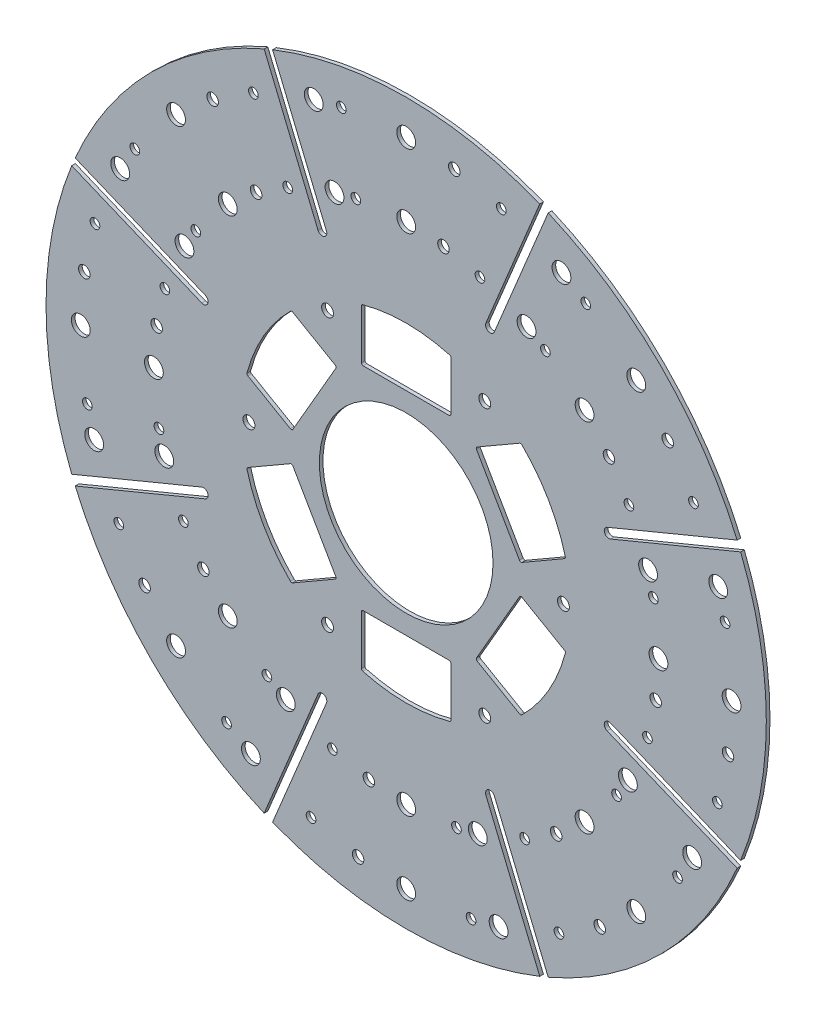
from build123d import *

# Parameters (mm, degrees)
ESBO_O1_R                = 197
ESBO_O1_R_2              = 47.5
RESSALTO_EXTRUS_O1_DEPTH = 2
CORTE_EXTRUS_O1_DEPTH    = 2
ESBO_O3_R                = 5.15
ESBO_O3_R_2              = 2.65
ESBO_O3_R_3              = 3.15
CORTE_EXTRUS_O2_DEPTH    = 2
CORTE_EXTRUS_O3_DEPTH    = 2
ESBO_O5_R                = 3.25
CORTE_EXTRUS_O4_DEPTH    = 2
FILETE1_R                = 1


with BuildPart() as part:
    # Esboço1 → Ressalto-extrusão1 (new body)
    with BuildSketch(Plane.XY):
        Circle(ESBO_O1_R)
        Circle(ESBO_O1_R_2, mode=Mode.SUBTRACT)
    extrude(amount=RESSALTO_EXTRUS_O1_DEPTH)

    # Esboço2 → Corte-extrusão1 (cut)
    with BuildSketch(Plane.XY.offset(2)):
        with BuildLine():
            Line((73.078937345, 182.960976486), (77.698335007, 181.047559324))
            Line((77.698335007, 181.047559324), (48.221743919, 109.884773346))
            ThreePointArc((48.221743919, 109.884773346), (44.955336507, 108.531783096), (43.602346257, 111.798190508))
            Line((43.602346257, 111.798190508), (73.078937345, 182.960976486))
        make_face()
        with BuildLine():
            Line((181.047559324, 77.698335007), (182.960976486, 73.078937345))
            Line((182.960976486, 73.078937345), (111.798190508, 43.602346257))
            ThreePointArc((111.798190508, 43.602346257), (108.531783096, 44.955336507), (109.884773346, 48.221743919))
            Line((109.884773346, 48.221743919), (181.047559324, 77.698335007))
        make_face()
        with BuildLine():
            Line((182.960976486, -73.078937345), (181.047559324, -77.698335007))
            Line((181.047559324, -77.698335007), (109.884773346, -48.221743919))
            ThreePointArc((109.884773346, -48.221743919), (108.531783096, -44.955336507), (111.798190508, -43.602346257))
            Line((111.798190508, -43.602346257), (182.960976486, -73.078937345))
        make_face()
        with BuildLine():
            Line((77.698335007, -181.047559324), (73.078937345, -182.960976486))
            Line((73.078937345, -182.960976486), (43.602346257, -111.798190508))
            ThreePointArc((43.602346257, -111.798190508), (44.955336507, -108.531783096), (48.221743919, -109.884773346))
            Line((48.221743919, -109.884773346), (77.698335007, -181.047559324))
        make_face()
        with BuildLine():
            Line((-73.078937345, -182.960976486), (-77.698335007, -181.047559324))
            Line((-77.698335007, -181.047559324), (-48.221743919, -109.884773346))
            ThreePointArc((-48.221743919, -109.884773346), (-44.955336507, -108.531783096), (-43.602346257, -111.798190508))
            Line((-43.602346257, -111.798190508), (-73.078937345, -182.960976486))
        make_face()
        with BuildLine():
            Line((-181.047559324, -77.698335007), (-182.960976486, -73.078937345))
            Line((-182.960976486, -73.078937345), (-111.798190508, -43.602346257))
            ThreePointArc((-111.798190508, -43.602346257), (-108.531783096, -44.955336507), (-109.884773346, -48.221743919))
            Line((-109.884773346, -48.221743919), (-181.047559324, -77.698335007))
        make_face()
        with BuildLine():
            Line((-182.960976486, 73.078937345), (-181.047559324, 77.698335007))
            Line((-181.047559324, 77.698335007), (-109.884773346, 48.221743919))
            ThreePointArc((-109.884773346, 48.221743919), (-108.531783096, 44.955336507), (-111.798190508, 43.602346257))
            Line((-111.798190508, 43.602346257), (-182.960976486, 73.078937345))
        make_face()
        with BuildLine():
            Line((-77.698335007, 181.047559324), (-73.078937345, 182.960976486))
            Line((-73.078937345, 182.960976486), (-43.602346257, 111.798190508))
            ThreePointArc((-43.602346257, 111.798190508), (-44.955336507, 108.531783096), (-48.221743919, 109.884773346))
            Line((-48.221743919, 109.884773346), (-77.698335007, 181.047559324))
        make_face()
    extrude(amount=-CORTE_EXTRUS_O1_DEPTH, mode=Mode.SUBTRACT)

    # Esboço3 → Corte-extrusão2 (cut)
    with BuildSketch(Plane.XY.offset(2)):
        with Locations((-50.554731357, 170.669912807)):
            Circle(ESBO_O3_R)
        with Locations((-39.194117569, 132.317123412)):
            Circle(ESBO_O3_R)
        with Locations((-35.487492326, 174.426597423)):
            Circle(ESBO_O3_R_2)
        with Locations((-27.51277495, 135.229609238)):
            Circle(ESBO_O3_R_2)
        with Locations((0, 178)):
            Circle(ESBO_O3_R)
        with Locations((0, 138)):
            Circle(ESBO_O3_R)
        with Locations((26.310075181, 176.044823678)):
            Circle(ESBO_O3_R_3)
        with Locations((20.397698736, 136.484189144)):
            Circle(ESBO_O3_R_3)
        with Locations((52.042163441, 170.222246561)):
            Circle(ESBO_O3_R_2)
        with Locations((40.347295252, 131.970056323)):
            Circle(ESBO_O3_R_2)
        with Locations((84.934259326, 156.429446054)):
            Circle(ESBO_O3_R)
        with Locations((65.847908916, 121.276761547)):
            Circle(ESBO_O3_R)
        with Locations((98.244783386, 148.431676328)):
            Circle(ESBO_O3_R_2)
        with Locations((76.167303973, 115.076243445)):
            Circle(ESBO_O3_R_2)
        with Locations((125.865007051, 125.865007051)):
            Circle(ESBO_O3_R)
        with Locations((97.580735804, 97.580735804)):
            Circle(ESBO_O3_R)
        with Locations((143.08652119, 105.878456042)):
            Circle(ESBO_O3_R_3)
        with Locations((110.932246765, 82.085544572)):
            Circle(ESBO_O3_R_3)
        with Locations((157.164671529, 83.565938176)):
            Circle(ESBO_O3_R_2)
        with Locations((121.846767815, 64.787075664)):
            Circle(ESBO_O3_R_2)
        with Locations((170.669912807, 50.554731357)):
            Circle(ESBO_O3_R)
        with Locations((132.317123412, 39.194117569)):
            Circle(ESBO_O3_R)
        with Locations((174.426597423, 35.487492326)):
            Circle(ESBO_O3_R_2)
        with Locations((135.229609238, 27.51277495)):
            Circle(ESBO_O3_R_2)
        with Locations((178, 0)):
            Circle(ESBO_O3_R)
        with Locations((138, 0)):
            Circle(ESBO_O3_R)
        with Locations((176.044823678, -26.310075181)):
            Circle(ESBO_O3_R_3)
        with Locations((136.484189144, -20.397698736)):
            Circle(ESBO_O3_R_3)
        with Locations((170.222246561, -52.042163441)):
            Circle(ESBO_O3_R_2)
        with Locations((131.970056323, -40.347295252)):
            Circle(ESBO_O3_R_2)
        with Locations((156.429446054, -84.934259326)):
            Circle(ESBO_O3_R)
        with Locations((121.276761547, -65.847908916)):
            Circle(ESBO_O3_R)
        with Locations((148.431676328, -98.244783386)):
            Circle(ESBO_O3_R_2)
        with Locations((115.076243445, -76.167303973)):
            Circle(ESBO_O3_R_2)
        with Locations((125.865007051, -125.865007051)):
            Circle(ESBO_O3_R)
        with Locations((97.580735804, -97.580735804)):
            Circle(ESBO_O3_R)
        with Locations((105.878456042, -143.08652119)):
            Circle(ESBO_O3_R_3)
        with Locations((82.085544572, -110.932246765)):
            Circle(ESBO_O3_R_3)
        with Locations((83.565938176, -157.164671529)):
            Circle(ESBO_O3_R_2)
        with Locations((64.787075664, -121.846767815)):
            Circle(ESBO_O3_R_2)
        with Locations((50.554731357, -170.669912807)):
            Circle(ESBO_O3_R)
        with Locations((39.194117569, -132.317123412)):
            Circle(ESBO_O3_R)
        with Locations((35.487492326, -174.426597423)):
            Circle(ESBO_O3_R_2)
        with Locations((27.51277495, -135.229609238)):
            Circle(ESBO_O3_R_2)
        with Locations((0, -178)):
            Circle(ESBO_O3_R)
        with Locations((0, -138)):
            Circle(ESBO_O3_R)
        with Locations((-26.310075181, -176.044823678)):
            Circle(ESBO_O3_R_3)
        with Locations((-20.397698736, -136.484189144)):
            Circle(ESBO_O3_R_3)
        with Locations((-52.042163441, -170.222246561)):
            Circle(ESBO_O3_R_2)
        with Locations((-40.347295252, -131.970056323)):
            Circle(ESBO_O3_R_2)
        with Locations((-84.934259326, -156.429446054)):
            Circle(ESBO_O3_R)
        with Locations((-65.847908916, -121.276761547)):
            Circle(ESBO_O3_R)
        with Locations((-98.244783386, -148.431676328)):
            Circle(ESBO_O3_R_2)
        with Locations((-76.167303973, -115.076243445)):
            Circle(ESBO_O3_R_2)
        with Locations((-125.865007051, -125.865007051)):
            Circle(ESBO_O3_R)
        with Locations((-97.580735804, -97.580735804)):
            Circle(ESBO_O3_R)
        with Locations((-143.08652119, -105.878456042)):
            Circle(ESBO_O3_R_3)
        with Locations((-110.932246765, -82.085544572)):
            Circle(ESBO_O3_R_3)
        with Locations((-157.164671529, -83.565938176)):
            Circle(ESBO_O3_R_2)
        with Locations((-121.846767815, -64.787075664)):
            Circle(ESBO_O3_R_2)
        with Locations((-170.669912807, -50.554731357)):
            Circle(ESBO_O3_R)
        with Locations((-132.317123412, -39.194117569)):
            Circle(ESBO_O3_R)
        with Locations((-174.426597423, -35.487492326)):
            Circle(ESBO_O3_R_2)
        with Locations((-135.229609238, -27.51277495)):
            Circle(ESBO_O3_R_2)
        with Locations((-178, 0)):
            Circle(ESBO_O3_R)
        with Locations((-138, 0)):
            Circle(ESBO_O3_R)
        with Locations((-176.044823678, 26.310075181)):
            Circle(ESBO_O3_R_3)
        with Locations((-136.484189144, 20.397698736)):
            Circle(ESBO_O3_R_3)
        with Locations((-170.222246561, 52.042163441)):
            Circle(ESBO_O3_R_2)
        with Locations((-131.970056323, 40.347295252)):
            Circle(ESBO_O3_R_2)
        with Locations((-156.429446054, 84.934259326)):
            Circle(ESBO_O3_R)
        with Locations((-121.276761547, 65.847908916)):
            Circle(ESBO_O3_R)
        with Locations((-148.431676328, 98.244783386)):
            Circle(ESBO_O3_R_2)
        with Locations((-115.076243445, 76.167303973)):
            Circle(ESBO_O3_R_2)
        with Locations((-125.865007051, 125.865007051)):
            Circle(ESBO_O3_R)
        with Locations((-97.580735804, 97.580735804)):
            Circle(ESBO_O3_R)
        with Locations((-105.878456042, 143.08652119)):
            Circle(ESBO_O3_R_3)
        with Locations((-82.085544572, 110.932246765)):
            Circle(ESBO_O3_R_3)
        with Locations((-83.565938176, 157.164671529)):
            Circle(ESBO_O3_R_2)
        with Locations((-64.787075664, 121.846767815)):
            Circle(ESBO_O3_R_2)
    extrude(amount=-CORTE_EXTRUS_O2_DEPTH, mode=Mode.SUBTRACT)

    # Esboço4 → Corte-extrusão3 (cut)
    with BuildSketch(Plane.XY.offset(2)):
        with BuildLine():
            Line((37.979473419, 50.217622393), (62.479473419, 7.782377607))
            Line((62.479473419, 7.782377607), (87.24874999, 22.082926103))
            ThreePointArc((87.24874999, 22.082926103), (77.942286341, 45), (62.74874999, 64.518170888))
            Line((62.74874999, 64.518170888), (37.979473419, 50.217622393))
        make_face()
        with BuildLine():
            Line((-24.5, 58), (24.5, 58))
            Line((24.5, 58), (24.5, 86.601096991))
            ThreePointArc((24.5, 86.601096991), (0, 90), (-24.5, 86.601096991))
            Line((-24.5, 86.601096991), (-24.5, 58))
        make_face()
        with BuildLine():
            Line((62.479473419, -7.782377607), (37.979473419, -50.217622393))
            Line((37.979473419, -50.217622393), (62.74874999, -64.518170888))
            ThreePointArc((62.74874999, -64.518170888), (77.942286341, -45), (87.24874999, -22.082926103))
            Line((87.24874999, -22.082926103), (62.479473419, -7.782377607))
        make_face()
        with BuildLine():
            Line((24.5, -58), (-24.5, -58))
            Line((-24.5, -58), (-24.5, -86.601096991))
            ThreePointArc((-24.5, -86.601096991), (0, -90), (24.5, -86.601096991))
            Line((24.5, -86.601096991), (24.5, -58))
        make_face()
        with BuildLine():
            Line((-37.979473419, -50.217622393), (-62.479473419, -7.782377607))
            Line((-62.479473419, -7.782377607), (-87.24874999, -22.082926103))
            ThreePointArc((-87.24874999, -22.082926103), (-77.942286341, -45), (-62.74874999, -64.518170888))
            Line((-62.74874999, -64.518170888), (-37.979473419, -50.217622393))
        make_face()
        with BuildLine():
            Line((-62.479473419, 7.782377607), (-37.979473419, 50.217622393))
            Line((-37.979473419, 50.217622393), (-62.74874999, 64.518170888))
            ThreePointArc((-62.74874999, 64.518170888), (-77.942286341, 45), (-87.24874999, 22.082926103))
            Line((-87.24874999, 22.082926103), (-62.479473419, 7.782377607))
        make_face()
    extrude(amount=-CORTE_EXTRUS_O3_DEPTH, mode=Mode.SUBTRACT)

    # Esboço5 → Corte-extrusão4 (cut)
    with BuildSketch(Plane.XY.offset(2)):
        with Locations((43, 74.478184725)):
            Circle(ESBO_O5_R)
        with Locations((86, 0)):
            Circle(ESBO_O5_R)
        with Locations((43, -74.478184725)):
            Circle(ESBO_O5_R)
        with Locations((-43, -74.478184725)):
            Circle(ESBO_O5_R)
        with Locations((-86, 0)):
            Circle(ESBO_O5_R)
        with Locations((-43, 74.478184725)):
            Circle(ESBO_O5_R)
    extrude(amount=-CORTE_EXTRUS_O4_DEPTH, mode=Mode.SUBTRACT)

    # Filete1
    filete1_edges = [part.edges().sort_by_distance(p)[0] for p in [
        (37.979473419, 50.217622393, 1),
        (62.74874999, 64.518170888, 1),
        (87.24874999, 22.082926103, 1),
        (62.479473419, 7.782377607, 1),
        (-24.5, 58, 1),
        (-24.5, 86.601096991, 1),
        (24.5, 86.601096991, 1),
        (24.5, 58, 1),
        (62.479473419, -7.782377607, 1),
        (87.24874999, -22.082926103, 1),
        (62.74874999, -64.518170888, 1),
        (37.979473419, -50.217622393, 1),
        (24.5, -58, 1),
        (24.5, -86.601096991, 1),
        (-24.5, -86.601096991, 1),
        (-24.5, -58, 1),
        (-37.979473419, -50.217622393, 1),
        (-62.74874999, -64.518170888, 1),
        (-87.24874999, -22.082926103, 1),
        (-62.479473419, -7.782377607, 1),
        (-62.479473419, 7.782377607, 1),
        (-87.24874999, 22.082926103, 1),
        (-62.74874999, 64.518170888, 1),
        (-37.979473419, 50.217622393, 1),
    ]]
    fillet(filete1_edges, radius=FILETE1_R)


solid = part.part
